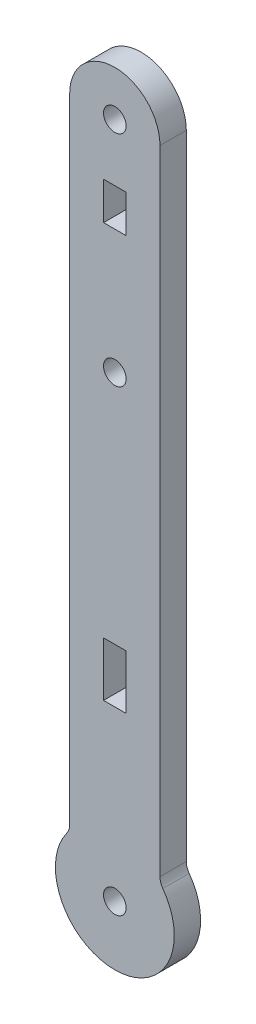
from build123d import *

# Parameters (mm, degrees)
SKETCH1_R           = 1.5
SKETCH1_W           = 3
SKETCH1_H           = 7.2
SKETCH1_H_2         = 5
BOSS_EXTRUDE1_DEPTH = 3.5
FILLET1_R           = 2


with BuildPart() as part:
    # Sketch1 → Boss-Extrude1 (new body)
    with BuildSketch(Plane.XY):
        with BuildLine():
            Line((-6, 90), (-6, 5.139066063))
            ThreePointArc((-6, 5.139066063), (0, -7.9), (6, 5.139066063))
            Line((6, 5.139066063), (6, 90))
            ThreePointArc((6, 90), (0, 96), (-6, 90))
        make_face()
        Circle(SKETCH1_R, mode=Mode.SUBTRACT)
        with Locations((0, 60.876985236)):
            Circle(SKETCH1_R, mode=Mode.SUBTRACT)
        with Locations((0, 90)):
            Circle(SKETCH1_R, mode=Mode.SUBTRACT)
        with Locations((0, 25.976985236)):
            Rectangle(SKETCH1_W, SKETCH1_H, mode=Mode.SUBTRACT)
        with Locations((0, 79.876985236)):
            Rectangle(SKETCH1_W, SKETCH1_H_2, mode=Mode.SUBTRACT)
    extrude(amount=BOSS_EXTRUDE1_DEPTH)

    # Fillet1
    fillet1_edges = [part.edges().sort_by_distance(p)[0] for p in [
        (6, 5.139066063, 1.75),
        (-6, 5.139066063, 1.75),
    ]]
    fillet(fillet1_edges, radius=FILLET1_R)


solid = part.part
